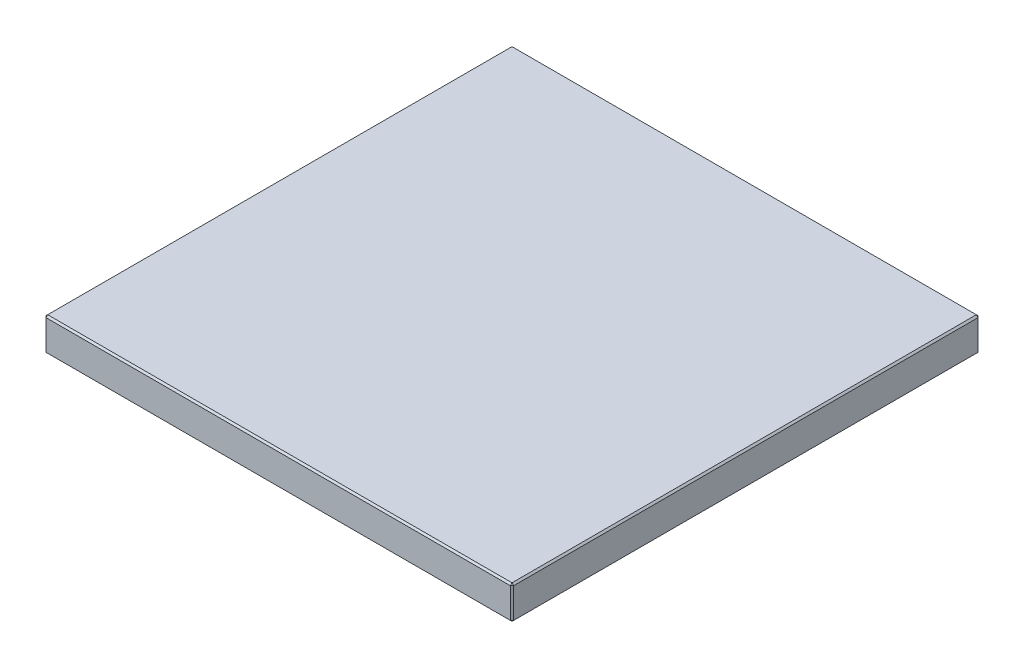
from build123d import *

# Parameters (mm, degrees)
SKETCH3_W           = 88.9
SKETCH3_H           = 6.35
BOSS_EXTRUDE1_DEPTH = 44.45
CHAMFER1_SIZE       = 0.3175


with BuildPart() as part:
    # Sketch3 → Boss-Extrude1 (new, symmetric)
    with BuildSketch(Plane.XY):
        Rectangle(SKETCH3_W, SKETCH3_H)
    extrude(amount=BOSS_EXTRUDE1_DEPTH, both=True)

    # Chamfer1
    chamfer1_edges = [part.edges().sort_by_distance(p)[0] for p in [
        (-44.45, 0, 44.45),
        (0, -3.175, 44.45),
        (44.45, 0, 44.45),
        (0, -3.175, -44.45),
        (-44.45, 0, -44.45),
        (0, 3.175, -44.45),
        (44.45, 0, -44.45),
        (0, 3.175, 44.45),
        (44.45, -3.175, 0),
        (-44.45, -3.175, 0),
        (-44.45, 3.175, 0),
        (44.45, 3.175, 0),
    ]]
    chamfer(chamfer1_edges, length=CHAMFER1_SIZE)


solid = part.part
